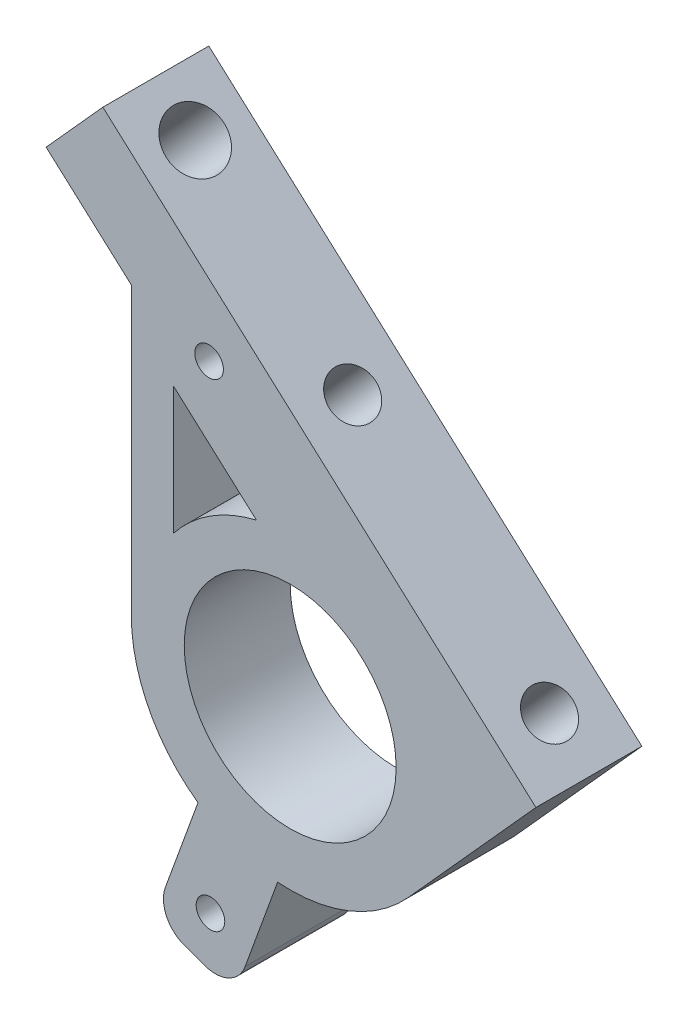
from build123d import *

# Parameters (mm, degrees)
SKETCH1_R                  = 10
EXTRUDE_3_8_DEPTH          = 10
BOSS_EXTRUDE2_DEPTH        = 10
SKETCH3_R                  = 1.35
M3_DRILL_OR_THROUGH_DEPTH  = 10
FILLET1_R                  = 3
SKETCH4_R                  = 2.75
M5_THROUGH_DEPTH           = 8
SKETCH5_R                  = 2.2
M5_DRILL_DEPTH             = 8
CUT_EXTRUDE4_DEPTH         = 10
SKETCH7_R                  = 1.35
M3_DRILL_OR_THROUGH2_DEPTH = 10


with BuildPart() as part:
    # Sketch1 → 3/8 (new body)
    with BuildSketch(Plane.XY):
        with BuildLine():
            Line((-15, 0), (-15, 26.962387961))
            Line((-15, 26.962387961), (-23.034486956, 34.196672509))
            Line((-23.034486956, 34.196672509), (-17.681442105, 40.141831113))
            Line((-17.681442105, 40.141831113), (23.191523297, 3.339647763))
            Line((23.191523297, 3.339647763), (17.838478446, -2.605510841))
            Line((17.838478446, -2.605510841), (11.147172382, -10.036959095))
            ThreePointArc((11.147172382, -10.036959095), (-5.375519243, -14.003706397), (-15, 0))
        make_face()
        Circle(SKETCH1_R, mode=Mode.SUBTRACT)
    extrude(amount=EXTRUDE_3_8_DEPTH)

    # Sketch2 → Boss-Extrude2 (add)
    with BuildSketch(Plane.XY):
        Polygon((-8.703298337, -12.216898054), (-1.18575737, -14.953059201), (-5.28999909, -26.22937065), (-12.807540057, -23.493209503), align=None)
    extrude(amount=BOSS_EXTRUDE2_DEPTH)

    # Sketch3 → M3_DRILL_or_Through (cut)
    with BuildSketch(Plane.XY.offset(10)):
        with Locations((-7.524443153, -20.673237657)):
            Circle(SKETCH3_R)
    extrude(amount=-M3_DRILL_OR_THROUGH_DEPTH, mode=Mode.SUBTRACT)

    # Fillet1
    fillet1_edges = [part.edges().sort_by_distance(p)[0] for p in [
        (-12.807540057, -23.493209503, 5),
        (-5.28999909, -26.22937065, 5),
    ]]
    fillet(fillet1_edges, radius=FILLET1_R)

    # Sketch4 → M5_through (cut)
    with BuildSketch(Plane(origin=(12.044350914, 13.376606859, 0), x_dir=(0.7431448254773932, -0.6691306063588595, 0), z_dir=(0.6691306063588595, 0.7431448254773932, 0))):
        with Locations(Location((-35, -5, 0), (0, 0, 180))):
            Circle(SKETCH4_R)
    extrude(amount=-M5_THROUGH_DEPTH, mode=Mode.SUBTRACT)

    # Sketch5 → M5_DRILL (cut)
    with BuildSketch(Plane(origin=(12.044350914, 13.376606859, 0), x_dir=(0.7431448254773932, -0.6691306063588595, 0), z_dir=(0.6691306063588595, 0.7431448254773932, 0))):
        with Locations(Location((-15, -5, 0), (0, 0, 180))):
            Circle(SKETCH5_R)
        with Locations(Location((10, -5, 0), (0, 0, 180))):
            Circle(SKETCH5_R)
    extrude(amount=-M5_DRILL_DEPTH, mode=Mode.SUBTRACT)

    # Sketch6 → Cut-Extrude4 (cut)
    with BuildSketch(Plane.XY.offset(10)):
        with BuildLine():
            Line((-11, 20.669506324), (-11, 8.660254038))
            ThreePointArc((-11, 8.660254038), (-7.515689996, 11.81162156), (-3.18503916, 13.632883978))
            Line((-3.18503916, 13.632883978), (-11, 20.669506324))
        make_face()
    extrude(amount=-CUT_EXTRUDE4_DEPTH, mode=Mode.SUBTRACT)

    # Sketch7 → M3_DRILL_or_Through2 (cut)
    with BuildSketch(Plane.XY.offset(10)):
        with Locations((-7.654346968, 24.385230452)):
            Circle(SKETCH7_R)
    extrude(amount=-M3_DRILL_OR_THROUGH2_DEPTH, mode=Mode.SUBTRACT)


solid = part.part
